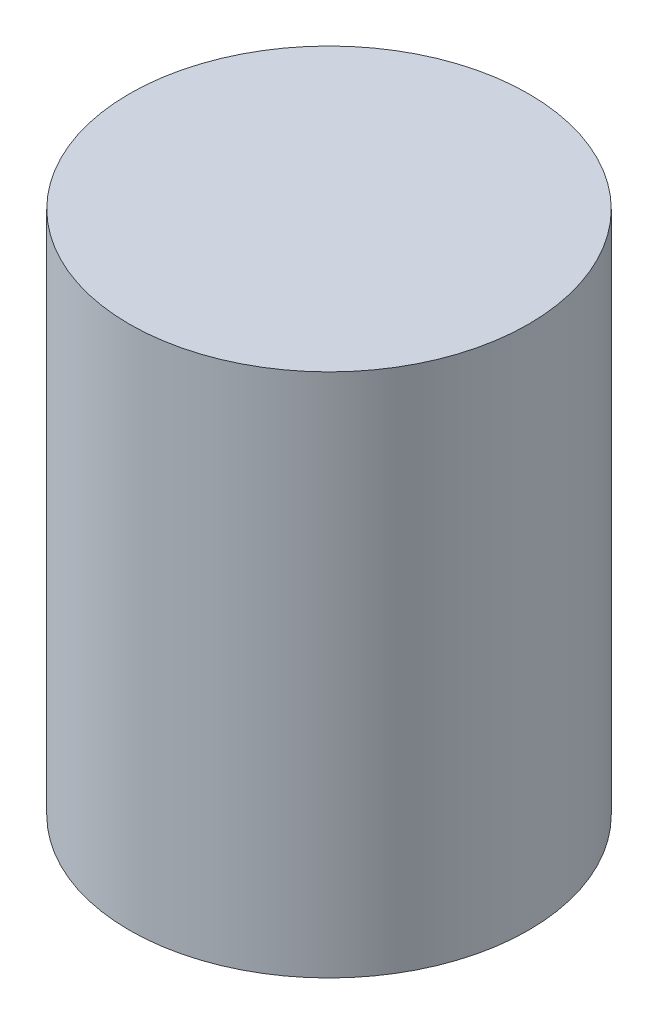
from build123d import *

# Parameters (mm, degrees)
SKETCH1_R           = 3.175
BOSS_EXTRUDE1_DEPTH = 8.349999936


with BuildPart() as part:
    # Sketch1 → Boss-Extrude1 (new body)
    with BuildSketch(Plane(origin=(0, 0, 0), x_dir=(1, 0, 0), z_dir=(0, 1, 0))):
        with Locations(Location((0, 0, 0), (0, 0, 270))):
            Circle(SKETCH1_R)
    extrude(amount=BOSS_EXTRUDE1_DEPTH)


solid = part.part
